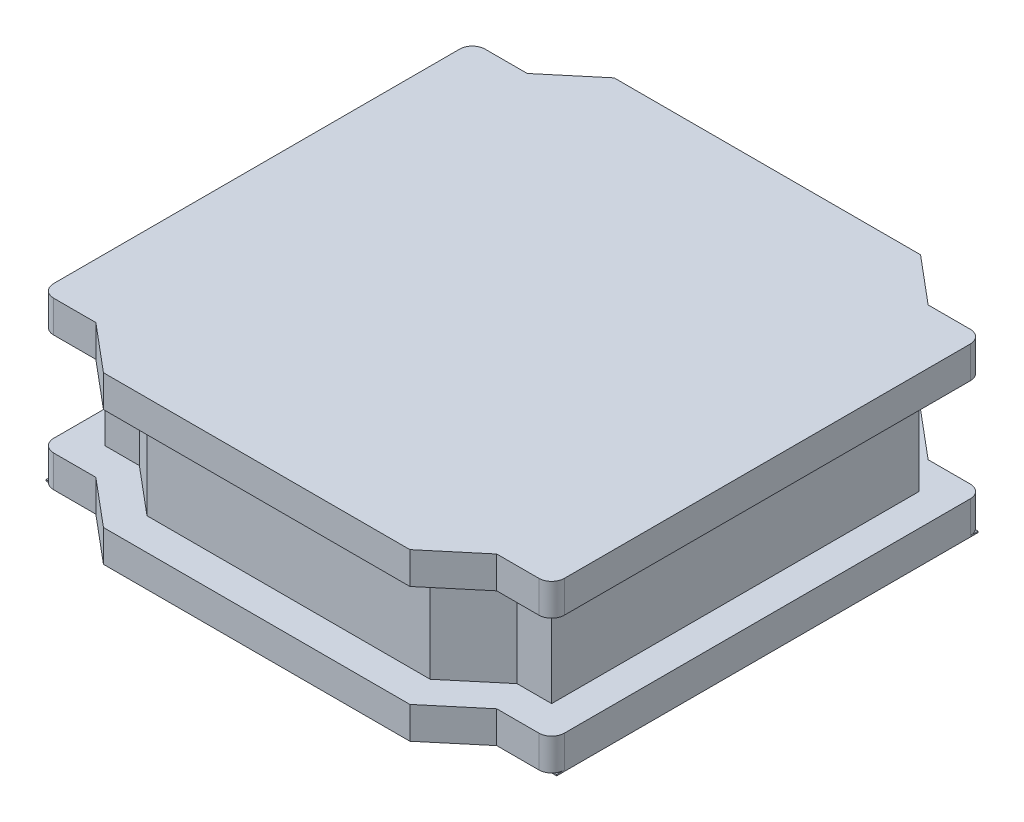
from build123d import *

# Parameters (mm, degrees)
SALIENTE_EXTRUIR1_DEPTH = 0.25
SALIENTE_EXTRUIR3_DEPTH = 0.8
SALIENTE_EXTRUIR2_DEPTH = 0.25
CROQUIS4_W              = 1.2
CROQUIS4_H              = 3.3
SALIENTE_EXTRUIR4_DEPTH = 0.01


with BuildPart() as part:
    # Croquis1 → Saliente-Extruir1 (new body)
    with BuildSketch(Plane(origin=(0, 0, 0), x_dir=(1, 0, 0), z_dir=(0, 1, 0))):
        with BuildLine():
            Line((1.287926846, 2), (-1.112073154, 2))
            Line((-1.112073154, 2), (-1.482101523, 1.689509332))
            Line((-1.482101523, 1.689509332), (-1.812073154, 1.689509332))
            ThreePointArc((-1.812073154, 1.689509332), (-1.882783832, 1.66022001), (-1.912073154, 1.589509332))
            Line((-1.912073154, 1.589509332), (-1.912073154, -1.589509332))
            ThreePointArc((-1.912073154, -1.589509332), (-1.882783832, -1.66022001), (-1.812073154, -1.689509332))
            Line((-1.812073154, -1.689509332), (-1.482101523, -1.689509332))
            Line((-1.482101523, -1.689509332), (-1.112073154, -2))
            Line((-1.112073154, -2), (1.287926846, -2))
            Line((1.287926846, -2), (1.657955215, -1.689509332))
            Line((1.657955215, -1.689509332), (1.987926846, -1.689509332))
            ThreePointArc((1.987926846, -1.689509332), (2.058637524, -1.66022001), (2.087926846, -1.589509332))
            Line((2.087926846, -1.589509332), (2.087926846, 1.589509332))
            ThreePointArc((2.087926846, 1.589509332), (2.058637524, 1.66022001), (1.987926846, 1.689509332))
            Line((1.987926846, 1.689509332), (1.657955215, 1.689509332))
            Line((1.657955215, 1.689509332), (1.287926846, 2))
        make_face()
    extrude(amount=SALIENTE_EXTRUIR1_DEPTH)

    # Croquis3 → Saliente-Extruir3 (add)
    with BuildSketch(Plane(origin=(0, 0.25, 0), x_dir=(1, 0, 0), z_dir=(0, 1, 0))):
        Polygon((-1.021080595, -1.75), (1.196934287, -1.75), (1.566962656, -1.439509332), (1.837926846, -1.439509332), (1.837926846, 1.439509332), (1.566962656, 1.439509332), (1.196934287, 1.75), (-1.021080595, 1.75), (-1.391108964, 1.439509332), (-1.662073154, 1.439509332), (-1.662073154, -1.439509332), (-1.391108964, -1.439509332), align=None)
    extrude(amount=SALIENTE_EXTRUIR3_DEPTH)

    # Croquis4 → Saliente-Extruir4 (add)
    with BuildSketch(Plane.XZ):
        with Locations((1.487926846, 0)):
            Rectangle(CROQUIS4_W, CROQUIS4_H)
        with Locations((-1.312073154, 0)):
            Rectangle(CROQUIS4_W, CROQUIS4_H)
    extrude(amount=SALIENTE_EXTRUIR4_DEPTH)


with BuildPart() as body_2:
    # Croquis2 → Saliente-Extruir2 (new body)
    with BuildSketch(Plane(origin=(0, 1.3, 0), x_dir=(1, 0, 0), z_dir=(0, 1, 0))):
        with BuildLine():
            Line((-1.112073154, -2), (1.287926846, -2))
            Line((1.287926846, -2), (1.657955215, -1.689509332))
            Line((1.657955215, -1.689509332), (1.987926846, -1.689509332))
            ThreePointArc((1.987926846, -1.689509332), (2.058637524, -1.66022001), (2.087926846, -1.589509332))
            Line((2.087926846, -1.589509332), (2.087926846, 1.589509332))
            ThreePointArc((2.087926846, 1.589509332), (2.058637524, 1.66022001), (1.987926846, 1.689509332))
            Line((1.987926846, 1.689509332), (1.657955215, 1.689509332))
            Line((1.657955215, 1.689509332), (1.287926846, 2))
            Line((1.287926846, 2), (-1.112073154, 2))
            Line((-1.112073154, 2), (-1.482101523, 1.689509332))
            Line((-1.482101523, 1.689509332), (-1.812073154, 1.689509332))
            ThreePointArc((-1.812073154, 1.689509332), (-1.882783832, 1.66022001), (-1.912073154, 1.589509332))
            Line((-1.912073154, 1.589509332), (-1.912073154, -1.589509332))
            ThreePointArc((-1.912073154, -1.589509332), (-1.882783832, -1.66022001), (-1.812073154, -1.689509332))
            Line((-1.812073154, -1.689509332), (-1.482101523, -1.689509332))
            Line((-1.482101523, -1.689509332), (-1.112073154, -2))
        make_face()
    extrude(amount=-SALIENTE_EXTRUIR2_DEPTH)


solid = Compound([part.part, body_2.part])
